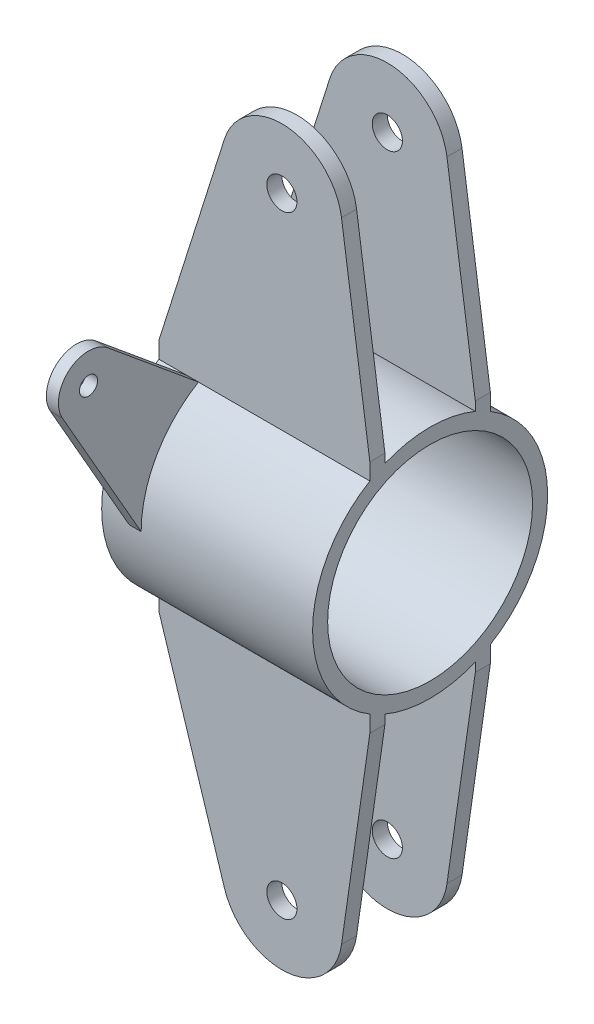
from build123d import *

# Parameters (mm, degrees)
SKETCH1_R             = 39.007
SKETCH1_R_2           = 34.007
BOSS_EXTRUDE1_DEPTH   = 35
BOSS_EXTRUDE2_START   = 15
SKETCH2_R             = 5.007
BOSS_EXTRUDE2_DEPTH   = 5
BOSS_EXTRUDE2_2_DEPTH = 5
BOSS_EXTRUDE3_START   = -15
SKETCH3_R             = 5.007
BOSS_EXTRUDE3_DEPTH   = 5
BOSS_EXTRUDE3_2_DEPTH = 5
BOSS_EXTRUDE4_DEPTH   = 70
BOSS_EXTRUDE5_START   = -4
SKETCH5_R             = 3
BOSS_EXTRUDE5_DEPTH   = 4


with BuildPart() as part:
    # Sketch1 → Boss-Extrude1 (new, symmetric)
    with BuildSketch(Plane(origin=(0, 0, 0), x_dir=(0, 0, -1), z_dir=(1, 0, 0))):
        Circle(SKETCH1_R)
        Circle(SKETCH1_R_2, mode=Mode.SUBTRACT)
    extrude(amount=BOSS_EXTRUDE1_DEPTH, both=True)



with BuildPart() as body_2:
    # Sketch2 → Boss-Extrude2 (new body)
    with BuildSketch(Plane.XY.offset(BOSS_EXTRUDE2_START)):
        with BuildLine():
            Line((-35, -39.007), (35, -39.007))
            Line((35, -39.007), (25.596649495, -104.444761639))
            ThreePointArc((25.596649495, -104.444761639), (7.437713907, -121.532834549), (-13.266839867, -107.637848746))
            Line((-13.266839867, -107.637848746), (-35, -39.007))
        make_face()
        with Locations((5.8, -101.6)):
            Circle(SKETCH2_R, mode=Mode.SUBTRACT)
    extrude(amount=BOSS_EXTRUDE2_DEPTH)


with BuildPart() as body_3:
    # Sketch2 → Boss-Extrude2 2 (new body)
    with BuildSketch(Plane.XY.offset(BOSS_EXTRUDE2_START)):
        with BuildLine():
            Line((35, 39.007), (-35, 39.007))
            Line((-35, 39.007), (-13.266839867, 107.637848746))
            ThreePointArc((-13.266839867, 107.637848746), (7.437713907, 121.532834549), (25.596649495, 104.444761639))
            Line((25.596649495, 104.444761639), (35, 39.007))
        make_face()
        with Locations((5.8, 101.6)):
            Circle(SKETCH2_R, mode=Mode.SUBTRACT)
    extrude(amount=BOSS_EXTRUDE2_2_DEPTH)


with BuildPart() as body_4:
    # Sketch3 → Boss-Extrude3 (new body)
    with BuildSketch(Plane.XY.offset(BOSS_EXTRUDE3_START)):
        with BuildLine():
            Line((-35, -39.007), (-13.266839867, -107.637848746))
            ThreePointArc((-13.266839867, -107.637848746), (7.437713907, -121.532834549), (25.596649495, -104.444761639))
            Line((25.596649495, -104.444761639), (35, -39.007))
            Line((35, -39.007), (-35, -39.007))
        make_face()
        with Locations((5.8, -101.6)):
            Circle(SKETCH3_R, mode=Mode.SUBTRACT)
    extrude(amount=-BOSS_EXTRUDE3_DEPTH)


with BuildPart() as body_5:
    # Sketch3 → Boss-Extrude3 2 (new body)
    with BuildSketch(Plane.XY.offset(BOSS_EXTRUDE3_START)):
        with BuildLine():
            Line((-35, 39.007), (35, 39.007))
            Line((35, 39.007), (25.596649495, 104.444761639))
            ThreePointArc((25.596649495, 104.444761639), (7.437713907, 121.532834549), (-13.266839867, 107.637848746))
            Line((-13.266839867, 107.637848746), (-35, 39.007))
        make_face()
        with Locations((5.8, 101.6)):
            Circle(SKETCH3_R, mode=Mode.SUBTRACT)
    extrude(amount=-BOSS_EXTRUDE3_2_DEPTH)


with BuildPart() as part_1:
    add(part.part)

    add(body_2.part)  # Boss-Extrude4 merges body 2

    add(body_3.part)  # Boss-Extrude4 merges body 3

    add(body_4.part)  # Boss-Extrude4 merges body 4

    add(body_5.part)  # Boss-Extrude4 merges body 5
    # Sketch4 → Boss-Extrude4 (add)
    with BuildSketch(Plane(origin=(35, 0, 0), x_dir=(0, 0, -1), z_dir=(1, 0, 0))):
        with BuildLine():
            Line((20, -39.007), (15, -39.007))
            Line((15, -39.007), (15, -36.007583215))
            ThreePointArc((15, -36.007583215), (17.545232866, -34.838353186), (20, -33.489491621))
            Line((20, -33.489491621), (20, -39.007))
        make_face()
        with BuildLine():
            Line((-20, -39.007), (-15, -39.007))
            Line((-15, -39.007), (-15, -36.007583215))
            ThreePointArc((-15, -36.007583215), (-17.545232866, -34.838353186), (-20, -33.489491621))
            Line((-20, -33.489491621), (-20, -39.007))
        make_face()
        with BuildLine():
            Line((-20, 39.007), (-15, 39.007))
            Line((-15, 39.007), (-15, 36.007583215))
            ThreePointArc((-15, 36.007583215), (-17.545232866, 34.838353186), (-20, 33.489491621))
            Line((-20, 33.489491621), (-20, 39.007))
        make_face()
        with BuildLine():
            Line((20, 39.007), (15, 39.007))
            Line((15, 39.007), (15, 36.007583215))
            ThreePointArc((15, 36.007583215), (17.545232866, 34.838353186), (20, 33.489491621))
            Line((20, 33.489491621), (20, 39.007))
        make_face()
    extrude(amount=-BOSS_EXTRUDE4_DEPTH)

    # Sketch5 → Boss-Extrude5 (add)
    with BuildSketch(Plane.ZY.offset(25.9).offset(BOSS_EXTRUDE5_START)):
        with BuildLine():
            Line((50.098811723, 58.375353815), (20, 33.489491621))
            ThreePointArc((20, 33.489491621), (33.924077357, 19.253649641), (39.007, 0))
            Line((39.007, 0), (65.151054806, 45.703054903))
            ThreePointArc((65.151054806, 45.703054903), (62.911300808, 58.318387785), (50.098811723, 58.375353815))
        make_face()
        with Locations((56.470917013, 50.668455984)):
            Circle(SKETCH5_R, mode=Mode.SUBTRACT)
    extrude(amount=BOSS_EXTRUDE5_DEPTH)


solid = part_1.part
